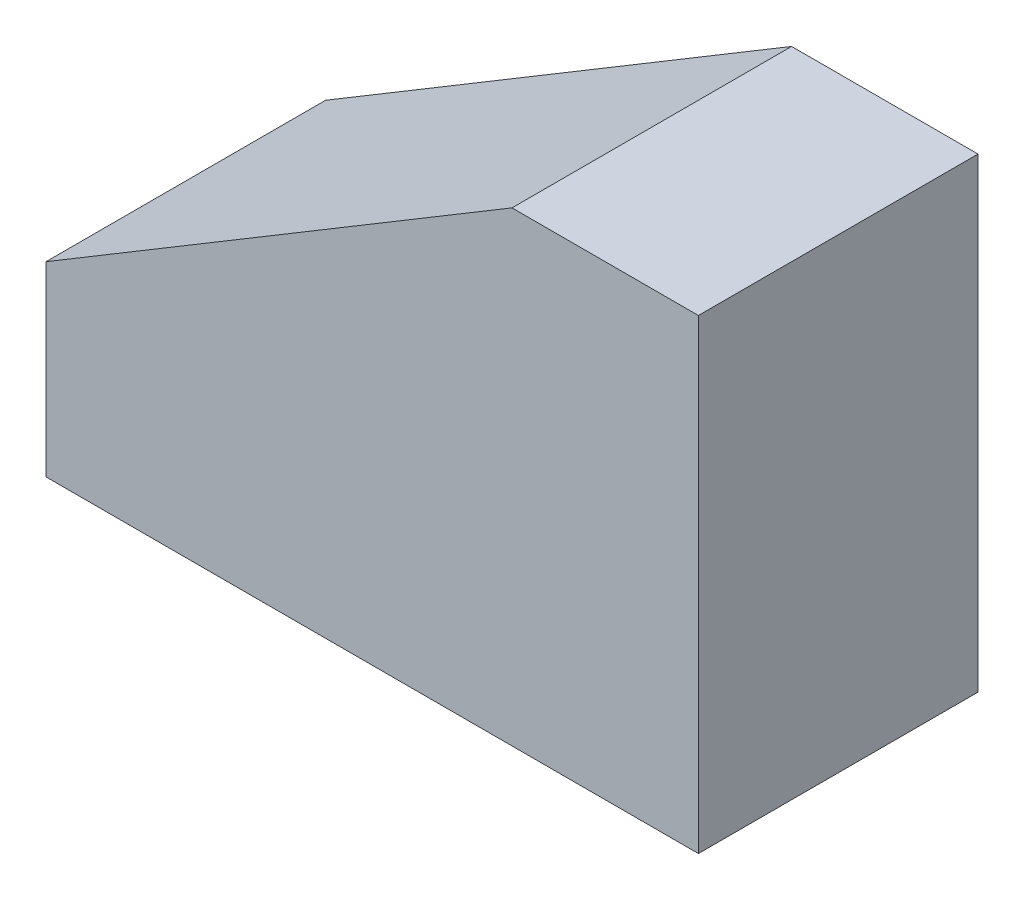
from build123d import *

# Parameters (mm, degrees)
BOSS_EXTRUDE1_DEPTH = 15


with BuildPart() as part:
    # Sketch1 → Boss-Extrude1 (new body)
    with BuildSketch(Plane.XY):
        Polygon((0, 0), (35, 0), (35, 25), (25, 25), (0, 10), align=None)
    extrude(amount=BOSS_EXTRUDE1_DEPTH)


solid = part.part
